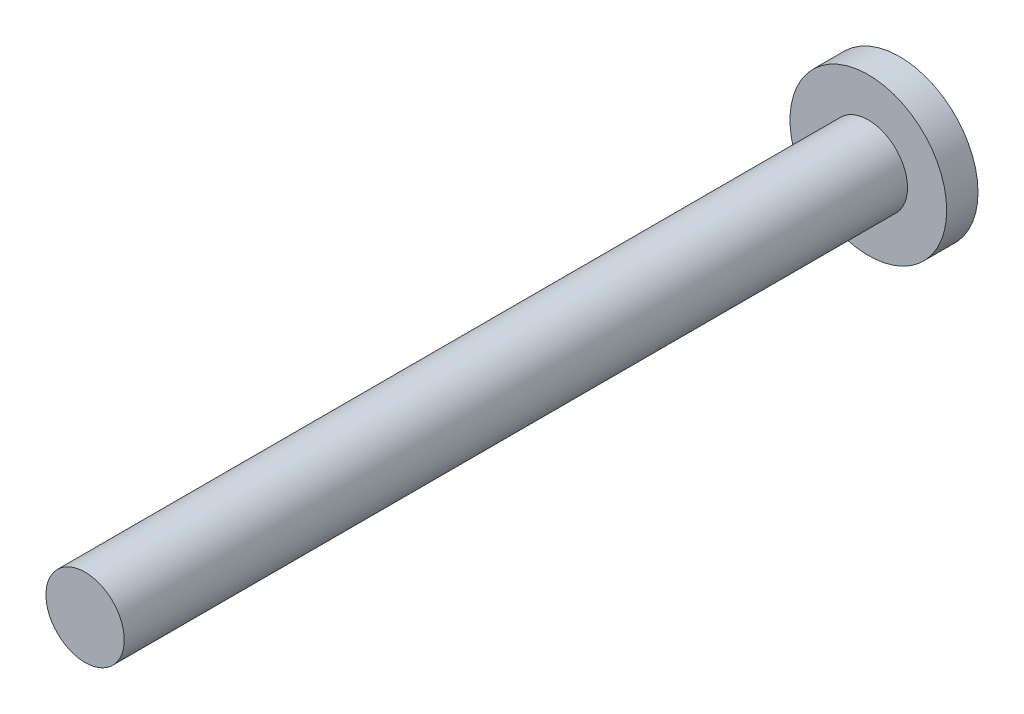
from build123d import *


with BuildPart() as part:
    # Sketch1 → Revolve2 (revolve)
    with BuildSketch(Plane(origin=(0, 0, 0), x_dir=(1, 0, 0), z_dir=(0, 1, 0))):
        Polygon((0, 0), (0, 52), (5, 52), (5, 50), (2.5, 50), (2.5, 0), align=None)
    revolve(axis=Axis((0, 0, 0), (0, 0, -1)))


solid = part.part
